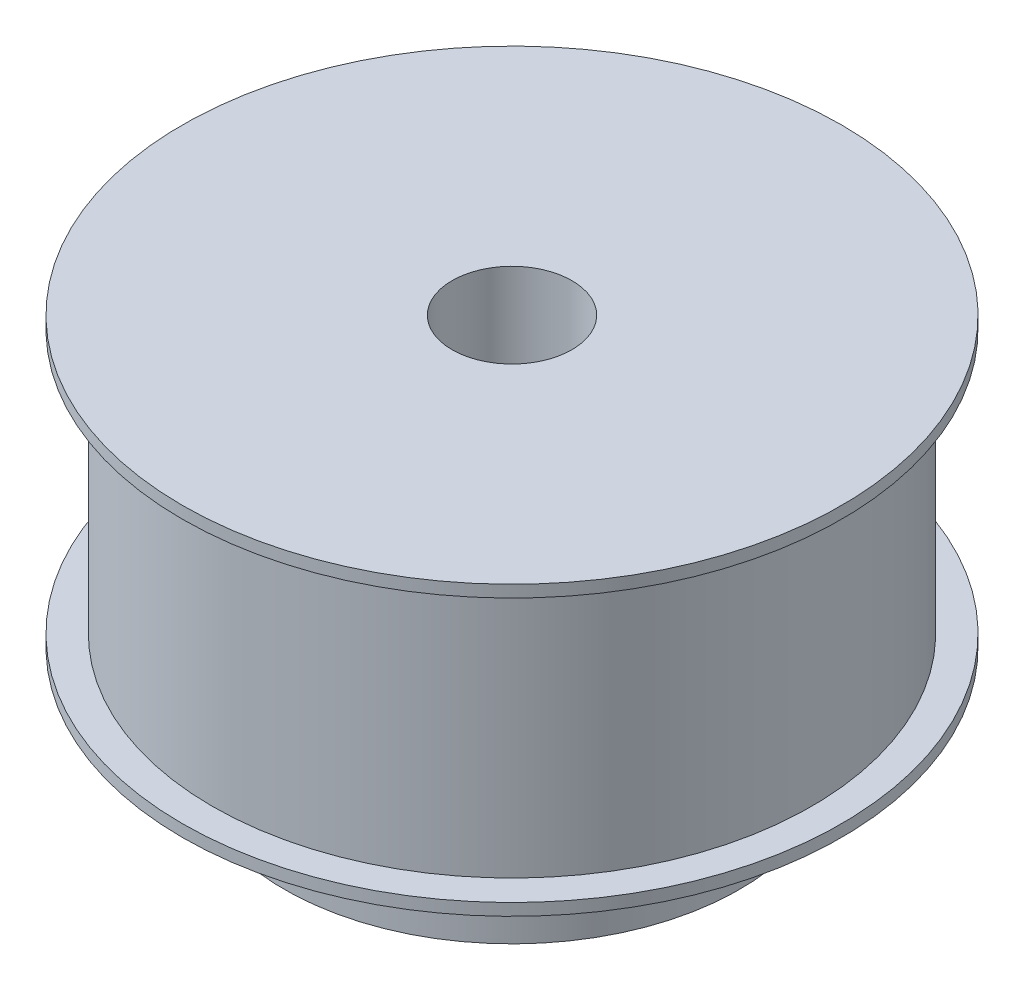
from build123d import *

# Parameters (mm, degrees)
SKETCH2_R          = 5
CUT_EXTRUDE1_DEPTH = 34


with BuildPart() as part:
    # Sketch1 → Revolve1 (revolve)
    with BuildSketch(Plane.XY, mode=Mode.PRIVATE) as revolve1_sk:
        Polygon((0, 0), (0, 22), (0, 23), (-27.5, 23), (-27.5, 22), (-25, 22), (-25, 0), (-27.5, 0), (-27.5, -1), (-19, -1), (-19, -9), (0, -9), (0, -1), align=None)
    revolve(revolve1_sk.sketch.rotate(Axis((0, 0, 0), (0, 1, 0)), 270), axis=Axis((0, 0, 0), (0, 1, 0)))

    # Sketch2 → Cut-Extrude1 (cut)
    with BuildSketch(Plane(origin=(0, 23, 0), x_dir=(1, 0, 0), z_dir=(0, 1, 0))):
        with Locations(Location((0, 0, 0), (0, 0, 270))):
            Circle(SKETCH2_R)
    extrude(amount=-CUT_EXTRUDE1_DEPTH, mode=Mode.SUBTRACT)


solid = part.part
